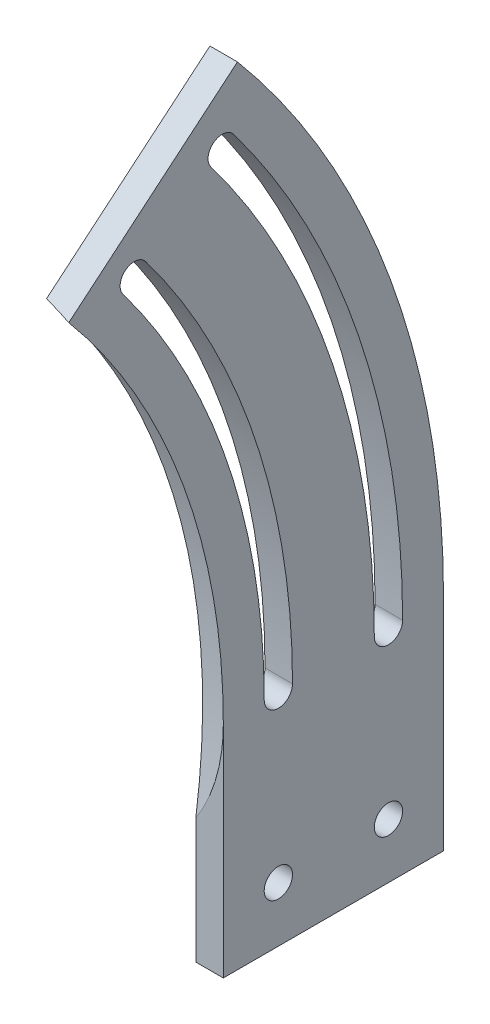
from build123d import *

# Parameters (mm, degrees)
BOSS_EXTRUDE1_DEPTH = 6.35
CUT_EXTRUDE4_DEPTH  = 6.35
SKETCH3_R           = 3.2639
CUT_EXTRUDE5_DEPTH  = 6.35


with BuildPart() as part:
    # Sketch1 → Boss-Extrude1 (new body)
    with BuildSketch(Plane(origin=(0, 0, 0), x_dir=(0, 0, -1), z_dir=(1, 0, 0))):
        with BuildLine():
            Line((152.4, 0), (152.4, -50.8))
            Line((152.4, -50.8), (203.2, -50.8))
            Line((203.2, -50.8), (203.2, 0))
            ThreePointArc((203.2, 0), (190.945540544, 69.498493124), (155.660230842, 130.614442288))
            Line((155.660230842, 130.614442288), (116.745173131, 97.960831716))
            ThreePointArc((116.745173131, 97.960831716), (143.209155408, 52.123869843), (152.4, 0))
        make_face()
    extrude(amount=BOSS_EXTRUDE1_DEPTH)

    # Sketch2 → Cut-Extrude4 (cut)
    with BuildSketch(Plane(origin=(6.35, 0, 0), x_dir=(0, 0, -1), z_dir=(1, 0, 0))):
        with BuildLine():
            ThreePointArc((134.46138915, 101.323924376), (129.890458655, 101.966326764), (129.248056268, 97.395396268))
            ThreePointArc((129.248056268, 97.395396268), (153.473001896, 51.351348104), (161.8361, 0))
            ThreePointArc((161.8361, 0), (165.1, -3.2639), (168.3639, 0))
            ThreePointArc((168.3639, 0), (159.663469053, 53.422649441), (134.46138915, 101.323924376))
        make_face()
        with BuildLine():
            ThreePointArc((154.746731105, 116.610025965), (150.17580061, 117.252428352), (149.533398223, 112.681497856))
            ThreePointArc((149.533398223, 112.681497856), (177.560422739, 59.410886377), (187.2361, 0))
            ThreePointArc((187.2361, 0), (190.5, -3.2639), (193.7639, 0))
            ThreePointArc((193.7639, 0), (183.750889895, 61.482187713), (154.746731105, 116.610025965))
        make_face()
    extrude(amount=-CUT_EXTRUDE4_DEPTH, mode=Mode.SUBTRACT)

    # Sketch3 → Cut-Extrude5 (cut)
    with BuildSketch(Plane(origin=(6.35, 0, 0), x_dir=(0, 0, -1), z_dir=(1, 0, 0))):
        with Locations((165.1, -38.1)):
            Circle(SKETCH3_R)
        with Locations((190.5, -38.1)):
            Circle(SKETCH3_R)
    extrude(amount=-CUT_EXTRUDE5_DEPTH, mode=Mode.SUBTRACT)

    # Sketch7 → Cut-Revolve1 (revolve, cut)
    with BuildSketch(Plane(origin=(0, 0, 0), x_dir=(1, 0, 0), z_dir=(0, 1, 0))):
        with BuildLine():
            Line((-25.4, 38.1), (-144.027789746, 38.1))
            ThreePointArc((-144.027789746, 38.1), (-25.4, 156.727789746), (93.227789746, 38.1))
            Line((93.227789746, 38.1), (-25.4, 38.1))
        make_face()
    revolve(axis=Axis((-1000, 0, 0), (1, 0, 0)), mode=Mode.SUBTRACT)


solid = part.part
